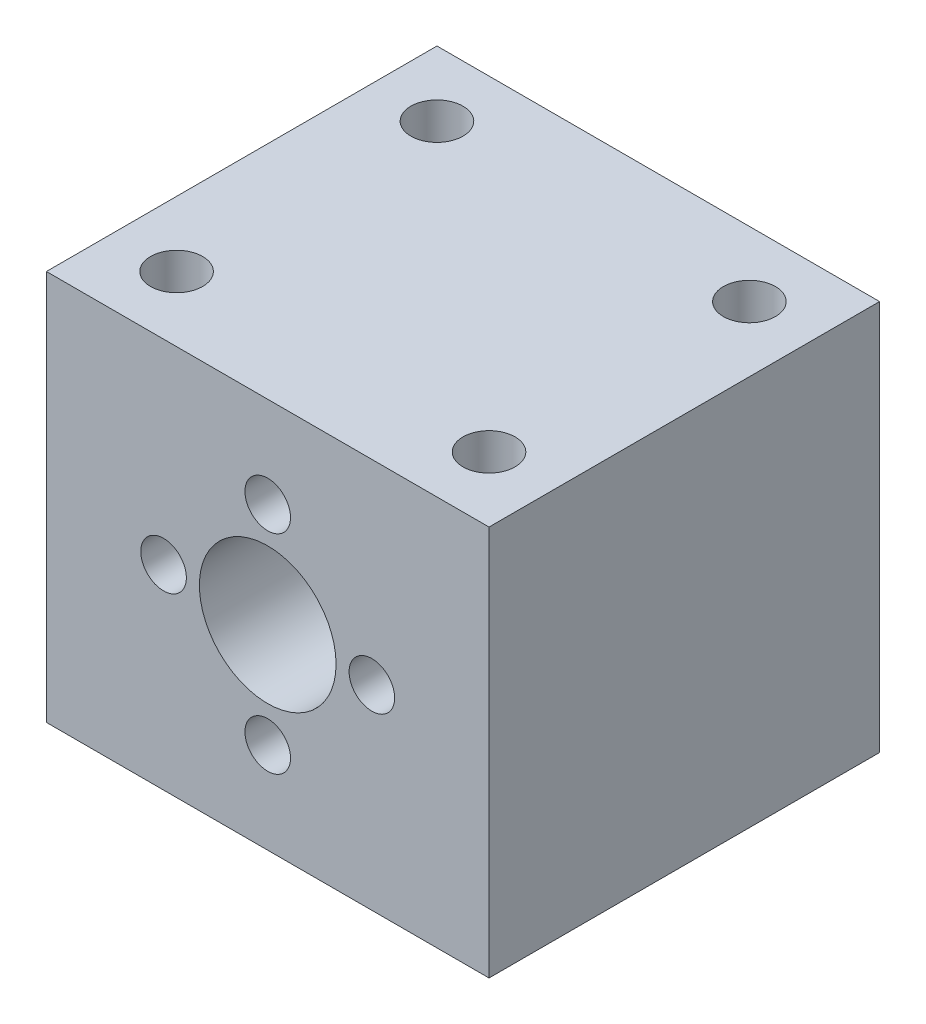
from build123d import *

# Parameters (mm, degrees)
SKETCH_1_W          = 34
SKETCH_1_H          = 30
SKETCH_1_R          = 5.25
EXTRUDE_1_DEPTH     = 30
SKETCH_2_R          = 1.75
CUT_EXTRUDE_1_DEPTH = 10
SKETCH_4_R          = 2
CUT_EXTRUDE_3_DEPTH = 10


with BuildPart() as part:
    # 草图1 → 凸台-拉伸1 (new body)
    with BuildSketch(Plane.XY):
        Rectangle(SKETCH_1_W, SKETCH_1_H)
        Circle(SKETCH_1_R, mode=Mode.SUBTRACT)
    extrude(amount=EXTRUDE_1_DEPTH)

    # 草图2 → 切除-拉伸1 (cut)
    with BuildSketch(Plane.XY.offset(30)):
        with Locations((-8, 0)):
            Circle(SKETCH_2_R)
        with Locations((0, 8)):
            Circle(SKETCH_2_R)
        with Locations((8, 0)):
            Circle(SKETCH_2_R)
        with Locations((0, -8)):
            Circle(SKETCH_2_R)
    extrude(amount=-CUT_EXTRUDE_1_DEPTH, mode=Mode.SUBTRACT)

    # 草图4 → 切除-拉伸3 (cut)
    with BuildSketch(Plane(origin=(0, 15, 0), x_dir=(1, 0, 0), z_dir=(0, 1, 0))):
        with Locations(Location((12, -25, 0), (0, 0, 180))):
            Circle(SKETCH_4_R)
        with Locations(Location((-12, -25, 0), (0, 0, 180))):
            Circle(SKETCH_4_R)
        with Locations(Location((-12, -5, 0), (0, 0, 180))):
            Circle(SKETCH_4_R)
        with Locations(Location((12, -5, 0), (0, 0, 180))):
            Circle(SKETCH_4_R)
    extrude(amount=-CUT_EXTRUDE_3_DEPTH, mode=Mode.SUBTRACT)


solid = part.part
